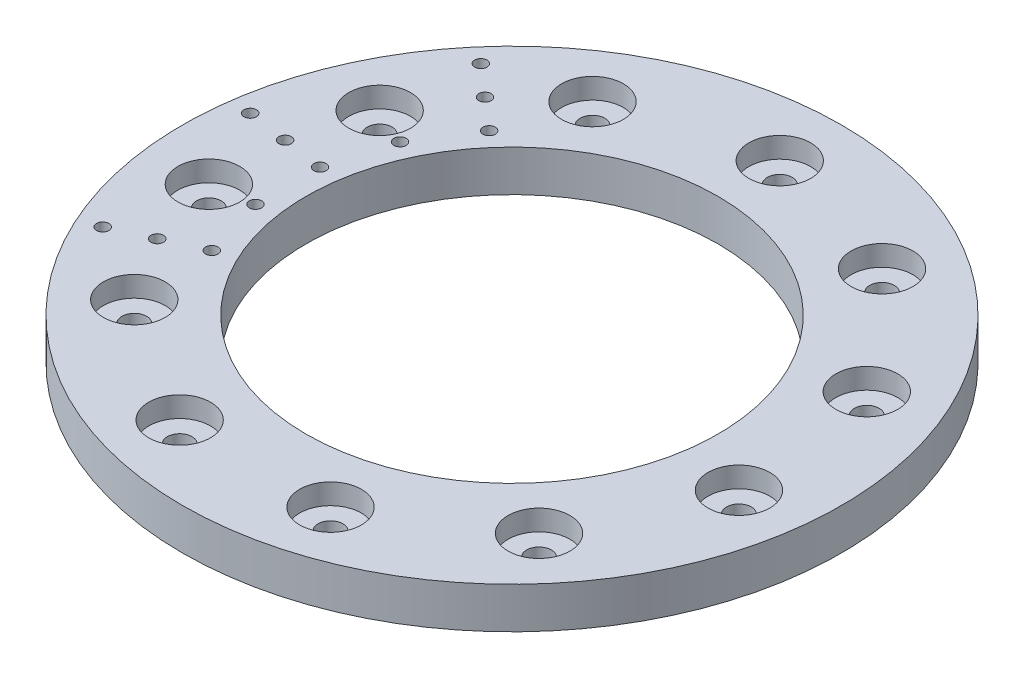
from build123d import *

# Parameters (mm, degrees)
SKETCH1_R               = 80
BOSS_EXTRUDE1_DEPTH     = 10
SKETCH3_R               = 3
CUT_EXTRUDE1_DEPTH      = 10
SKETCH4_R               = 7.5
CUT_EXTRUDE2_DEPTH      = 5
SKETCH5_R               = 50
CUT_EXTRUDE3_DEPTH      = 21
CUT_EXTRUDE4_DEPTH      = 114.578166916
CUT_EXTRUDE4_DEPTH_BACK = 114.578166916
SKETCH6_R               = 1.5


with BuildPart() as part:
    # Sketch1 → Boss-Extrude1 (new body)
    with BuildSketch(Plane(origin=(0, 0, 0), x_dir=(1, 0, 0), z_dir=(0, 1, 0))):
        with Locations(Location((0, 0, 0), (0, 0, 270))):
            Circle(SKETCH1_R)
    extrude(amount=BOSS_EXTRUDE1_DEPTH)

    # Sketch3 → Cut-Extrude1 (cut)
    with BuildSketch(Plane(origin=(0, 10, 0), x_dir=(1, 0, 0), z_dir=(0, 1, 0))):
        with Locations(Location((0, 65, 0), (0, 0, 270))):
            Circle(SKETCH3_R)
        with Locations(Location((35.141653135, 54.681479634, 0), (0, 0, 270))):
            Circle(SKETCH3_R)
        with Locations(Location((59.126079698, 27.001975845, 0), (0, 0, 270))):
            Circle(SKETCH3_R)
        with Locations(Location((64.338393722, -9.250464488, 0), (0, 0, 270))):
            Circle(SKETCH3_R)
        with Locations(Location((49.123722333, -42.565947706, 0), (0, 0, 270))):
            Circle(SKETCH3_R)
        with Locations(Location((18.312616195, -62.367043285, 0), (0, 0, 270))):
            Circle(SKETCH3_R)
        with Locations(Location((-18.312616195, -62.367043285, 0), (0, 0, 270))):
            Circle(SKETCH3_R)
        with Locations(Location((-49.123722333, -42.565947706, 0), (0, 0, 270))):
            Circle(SKETCH3_R)
        with Locations(Location((-64.338393722, -9.250464488, 0), (0, 0, 270))):
            Circle(SKETCH3_R)
        with Locations(Location((-59.126079698, 27.001975845, 0), (0, 0, 270))):
            Circle(SKETCH3_R)
        with Locations(Location((-35.141653135, 54.681479634, 0), (0, 0, 270))):
            Circle(SKETCH3_R)
    extrude(amount=-CUT_EXTRUDE1_DEPTH, mode=Mode.SUBTRACT)

    # Sketch4 → Cut-Extrude2 (cut)
    with BuildSketch(Plane(origin=(0, 10, 0), x_dir=(1, 0, 0), z_dir=(0, 1, 0))):
        with Locations(Location((0, 65, 0), (0, 0, 270))):
            Circle(SKETCH4_R)
        with Locations(Location((35.141653135, 54.681479634, 0), (0, 0, 270))):
            Circle(SKETCH4_R)
        with Locations(Location((59.126079698, 27.001975845, 0), (0, 0, 270))):
            Circle(SKETCH4_R)
        with Locations(Location((64.338393722, -9.250464488, 0), (0, 0, 270))):
            Circle(SKETCH4_R)
        with Locations(Location((49.123722333, -42.565947706, 0), (0, 0, 270))):
            Circle(SKETCH4_R)
        with Locations(Location((18.312616195, -62.367043285, 0), (0, 0, 270))):
            Circle(SKETCH4_R)
        with Locations(Location((-18.312616195, -62.367043285, 0), (0, 0, 270))):
            Circle(SKETCH4_R)
        with Locations(Location((-49.123722333, -42.565947706, 0), (0, 0, 270))):
            Circle(SKETCH4_R)
        with Locations(Location((-64.338393722, -9.250464488, 0), (0, 0, 270))):
            Circle(SKETCH4_R)
        with Locations(Location((-59.126079698, 27.001975845, 0), (0, 0, 270))):
            Circle(SKETCH4_R)
        with Locations(Location((-35.141653135, 54.681479634, 0), (0, 0, 270))):
            Circle(SKETCH4_R)
    extrude(amount=-CUT_EXTRUDE2_DEPTH, mode=Mode.SUBTRACT)

    # Sketch5 → Cut-Extrude3 (cut)
    with BuildSketch(Plane(origin=(0, 10, 0), x_dir=(1, 0, 0), z_dir=(0, 1, 0))):
        with Locations(Location((0, 0, 0), (0, 0, 270))):
            Circle(SKETCH5_R)
    extrude(amount=-CUT_EXTRUDE3_DEPTH, mode=Mode.SUBTRACT)

    # Sketch6 → Cut-Extrude4 (cut, two sides: drawn at the far end of the back side and taken through both)
    with BuildSketch(Plane(origin=(0, 10, 0), x_dir=(1, 0, 0), z_dir=(0, 1, 0)).offset(-CUT_EXTRUDE4_DEPTH_BACK)):
        with Locations(Location((-56.681218077, 49.114555046, 0), (0, 0, 270))):
            Circle(SKETCH6_R)
        with Locations(Location((-49.123722333, 42.565947706, 0), (0, 0, 270))):
            Circle(SKETCH6_R)
        with Locations(Location((-41.566226589, 36.017340367, 0), (0, 0, 270))):
            Circle(SKETCH6_R)
        with Locations(Location((-54.43918532, 7.834226299, 0), (0, 0, 270))):
            Circle(SKETCH6_R)
        with Locations(Location((-64.337219014, 9.258631081, 0), (0, 0, 270))):
            Circle(SKETCH6_R)
        with Locations(Location((-74.235252709, 10.683035863, 0), (0, 0, 270))):
            Circle(SKETCH6_R)
        with Locations(Location((-50.03555842, -22.83512412, 0), (0, 0, 270))):
            Circle(SKETCH6_R)
        with Locations(Location((-59.132932678, -26.986964869, 0), (0, 0, 270))):
            Circle(SKETCH6_R)
        with Locations(Location((-68.230306936, -31.138805619, 0), (0, 0, 270))):
            Circle(SKETCH6_R)
        with Locations(Location((-50.029759744, 22.847825715, 0), (0, 0, 270))):
            Circle(SKETCH6_R)
        with Locations(Location((-54.440179303, -7.827316105, 0), (0, 0, 270))):
            Circle(SKETCH6_R)
    extrude(amount=CUT_EXTRUDE4_DEPTH + CUT_EXTRUDE4_DEPTH_BACK, mode=Mode.SUBTRACT)


solid = part.part
